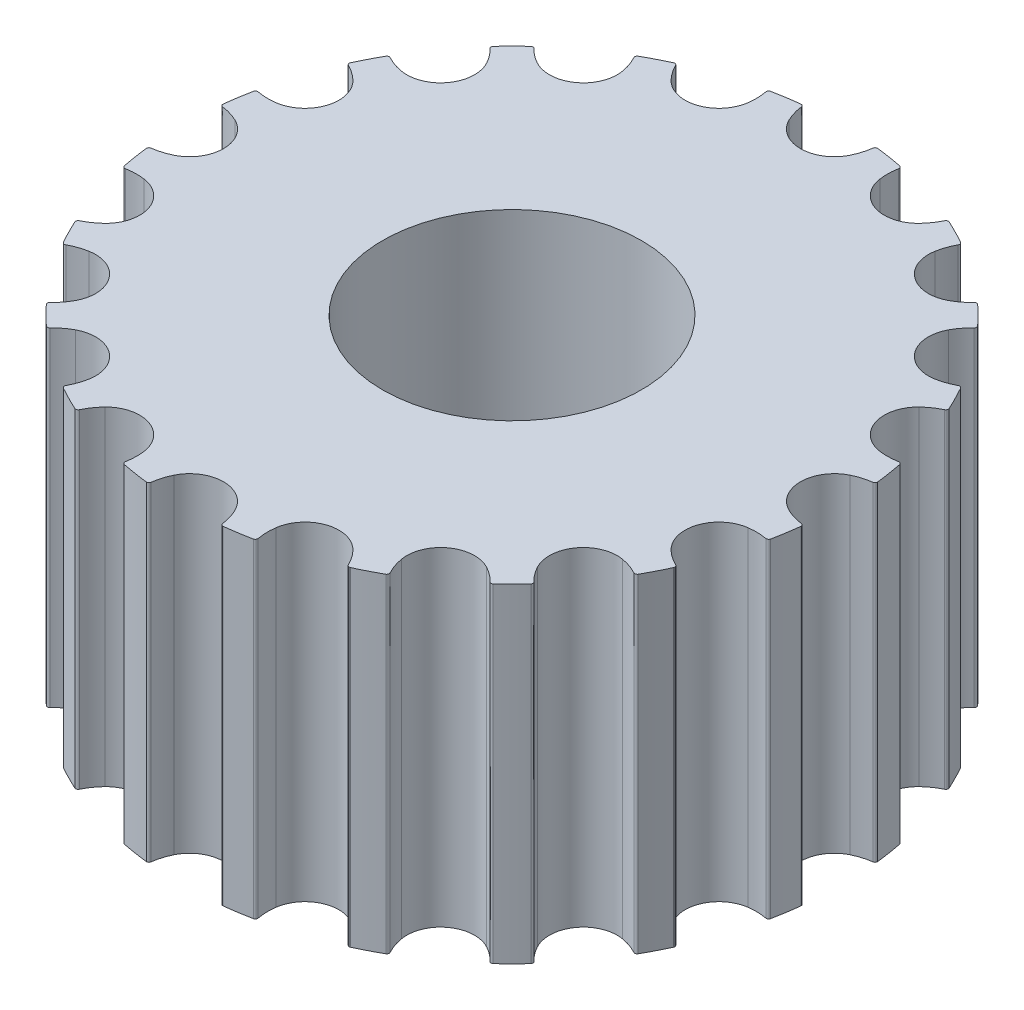
from build123d import *

# Parameters (mm, degrees)
SKETCH1_R           = 6.365
SKETCH1_R_2         = 2.5
BOSS_EXTRUDE1_DEPTH = 3.175
CUT_EXTRUDE1_DEPTH  = 12.015849945
CIRPATTERN1_COUNT   = 20


with BuildPart() as part:
    # Sketch1 → Boss-Extrude1 (new, symmetric)
    with BuildSketch(Plane(origin=(0, 0, 0), x_dir=(1, 0, 0), z_dir=(0, 1, 0))):
        with Locations(Location((0, 0, 0), (0, 0, 270))):
            Circle(SKETCH1_R)
        with Locations(Location((0, 0, 0), (0, 0, 270))):
            Circle(SKETCH1_R_2, mode=Mode.SUBTRACT)
    extrude(amount=BOSS_EXTRUDE1_DEPTH, both=True)

    # Sketch2 → Cut-Extrude1 (cut, through all)
    with BuildSketch(Plane(origin=(0, 3.175, 0), x_dir=(1, 0, 0), z_dir=(0, 1, 0))):
        with BuildLine():
            ThreePointArc((0.690602581, 6.278338356), (0.707206401, 6.309407088), (0.740175425, 6.321816617))
            ThreePointArc((0.740175425, 6.321816617), (0, 6.365), (-0.740175425, 6.321816617))
            ThreePointArc((-0.740175425, 6.321816617), (-0.707206401, 6.309407088), (-0.690602581, 6.278338356))
            ThreePointArc((-0.690602581, 6.278338356), (-0.653372886, 6.104948248), (-0.588764045, 5.939794145))
            ThreePointArc((-0.588764045, 5.939794145), (0, 5.571816617), (0.588764045, 5.939794145))
            ThreePointArc((0.588764045, 5.939794145), (0.653372886, 6.104948248), (0.690602581, 6.278338356))
        make_face()
    cut_extrude1 = extrude(amount=-CUT_EXTRUDE1_DEPTH, mode=Mode.SUBTRACT)

    # CirPattern1: Cut-Extrude1 ×20 about axis
    cirpattern1_axis = Axis((0, 0, 0), (0, 1, 0))
    for i in range(1, CIRPATTERN1_COUNT):
        add(cut_extrude1.rotate(cirpattern1_axis, i * 360 / CIRPATTERN1_COUNT), mode=Mode.SUBTRACT)


solid = part.part
